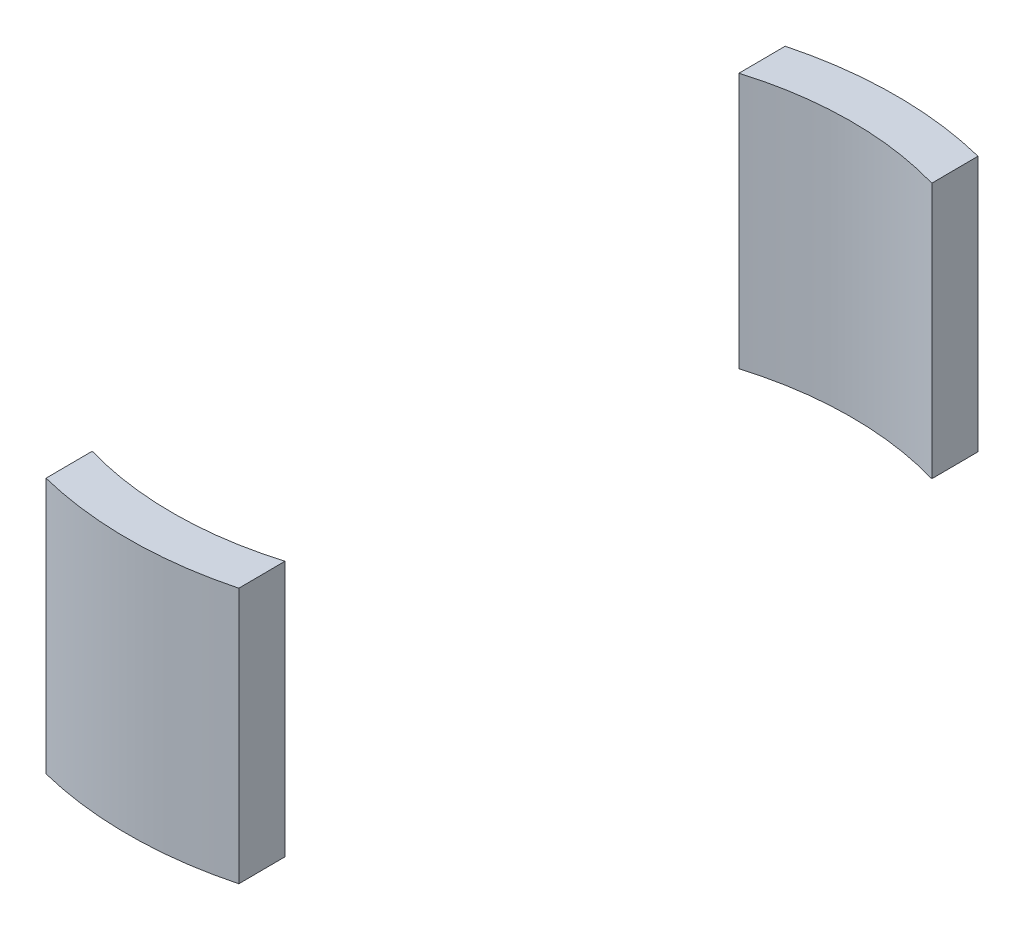
from build123d import *

# Parameters (mm, degrees)
BOSS_EXTRUDE1_DEPTH   = 2
BOSS_EXTRUDE1_2_DEPTH = 2


with BuildPart() as part:
    # Sketch1 → Boss-Extrude1 (new body)
    with BuildSketch(Plane(origin=(0, 0, 0), x_dir=(1, 0, 0), z_dir=(0, 1, 0))):
        with BuildLine():
            Line((-0.766460076, 2.900437717), (-0.764242747, 2.537406752))
            ThreePointArc((-0.764242747, 2.537406752), (-0.016185432, 2.649950572), (0.733190816, 2.546552813))
            Line((0.733190816, 2.546552813), (0.730973487, 2.909583778))
            ThreePointArc((0.730973487, 2.909583778), (-0.01832313, 2.999944043), (-0.766460076, 2.900437717))
        make_face()
    extrude(amount=BOSS_EXTRUDE1_DEPTH)


with BuildPart() as body_2:
    # Sketch1 → Boss-Extrude1 2 (new body)
    with BuildSketch(Plane(origin=(0, 0, 0), x_dir=(1, 0, 0), z_dir=(0, 1, 0))):
        with BuildLine():
            Line((-0.733190816, -2.546552813), (-0.730973487, -2.909583778))
            ThreePointArc((-0.730973487, -2.909583778), (0.01832313, -2.999944043), (0.766460076, -2.900437717))
            Line((0.766460076, -2.900437717), (0.764242747, -2.537406752))
            ThreePointArc((0.764242747, -2.537406752), (0.016185432, -2.649950572), (-0.733190816, -2.546552813))
        make_face()
    extrude(amount=BOSS_EXTRUDE1_2_DEPTH)


solid = Compound([part.part, body_2.part])
